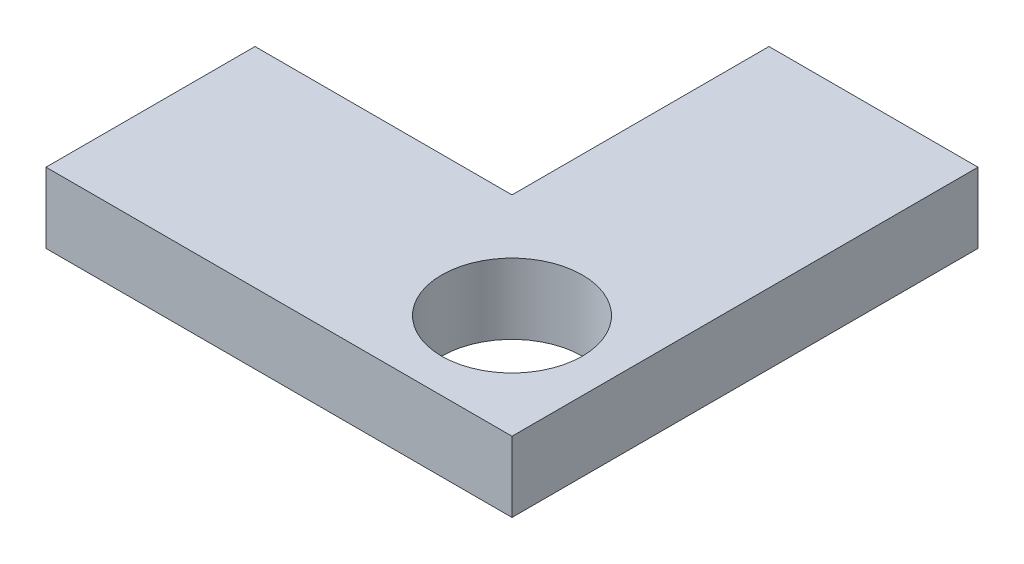
from build123d import *

# Parameters (mm, degrees)
SKETCH1_R           = 5
BOSS_EXTRUDE1_DEPTH = 5


with BuildPart() as part:
    # Sketch1 → Boss-Extrude1 (new body)
    with BuildSketch(Plane(origin=(0, 0, 0), x_dir=(1, 0, 0), z_dir=(0, 1, 0))):
        Polygon((-25.682296151, 7.424382041), (-7.424382041, 7.424382041), (-7.424382041, 25.682296151), (7.424382041, 25.682296151), (7.424382041, -7.424382041), (-25.682296151, -7.424382041), align=None)
        with Locations(Location((0, 0, 0), (0, 0, 270))):
            Circle(SKETCH1_R, mode=Mode.SUBTRACT)
    extrude(amount=BOSS_EXTRUDE1_DEPTH)


solid = part.part
